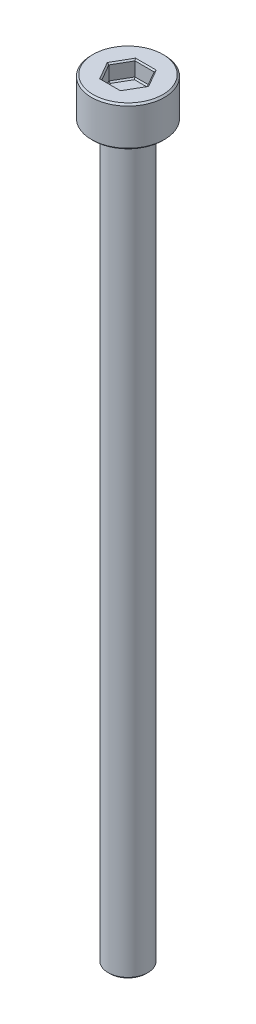
from build123d import *

# Parameters (mm, degrees)
SKETCH1_R           = 2.75
BOSS_EXTRUDE1_DEPTH = 3
SKETCH2_R           = 1.5
BOSS_EXTRUDE2_DEPTH = 55
CHAMFER1_SIZE       = 0.125
CHAMFER2_SIZE       = 0.125
CUT_EXTRUDE1_DEPTH  = 1.25
CHAMFER3_SIZE       = 0.1
CHAMFER4_SIZE       = 0.1


with BuildPart() as part:
    # Sketch1 → Boss-Extrude1 (new body)
    with BuildSketch(Plane(origin=(0, 0, 0), x_dir=(1, 0, 0), z_dir=(0, 1, 0))):
        with Locations(Location((0, 0, 0), (0, 0, 270))):
            Circle(SKETCH1_R)
    extrude(amount=BOSS_EXTRUDE1_DEPTH)

    # Sketch2 → Boss-Extrude2 (add)
    with BuildSketch(Plane(origin=(0, 0, 0), x_dir=(-1, 0, 0), z_dir=(0, -1, 0))):
        with Locations(Location((0, 0, 0), (0, 0, 90))):
            Circle(SKETCH2_R)
    extrude(amount=BOSS_EXTRUDE2_DEPTH)

    # Chamfer1
    chamfer1_edges = [part.edges().sort_by_distance(p)[0] for p in [
        (0, 0, -2.75),
        (0, 3, -2.75),
    ]]
    chamfer(chamfer1_edges, length=CHAMFER1_SIZE)

    # Chamfer2
    chamfer2_edges = [part.edges().sort_by_distance(p)[0] for p in [
        (0, -55, 1.5),
    ]]
    chamfer(chamfer2_edges, length=CHAMFER2_SIZE)

    # Sketch3 → Cut-Extrude1 (cut)
    with BuildSketch(Plane(origin=(0, 3, 0), x_dir=(1, 0, 0), z_dir=(0, 1, 0))):
        Polygon((1.443375673, 0), (0.721687836, 1.25), (-0.721687836, 1.25), (-1.443375673, 0), (-0.721687836, -1.25), (0.721687836, -1.25), align=None)
    extrude(amount=-CUT_EXTRUDE1_DEPTH, mode=Mode.SUBTRACT)

    # Chamfer3
    chamfer3_edges = [part.edges().sort_by_distance(p)[0] for p in [
        (1.082531755, 3, 0.625),
        (1.082531755, 3, -0.625),
        (0, 3, -1.25),
        (-1.082531755, 3, -0.625),
        (-1.082531755, 3, 0.625),
        (0, 3, 1.25),
    ]]
    chamfer(chamfer3_edges, length=CHAMFER3_SIZE)

    # Chamfer4
    chamfer4_edges = [part.edges().sort_by_distance(p)[0] for p in [
        (1.082531755, 1.75, 0.625),
        (0, 1.75, 1.25),
        (-1.082531755, 1.75, 0.625),
        (-1.082531755, 1.75, -0.625),
        (0, 1.75, -1.25),
        (1.082531755, 1.75, -0.625),
    ]]
    chamfer(chamfer4_edges, length=CHAMFER4_SIZE)


solid = part.part
